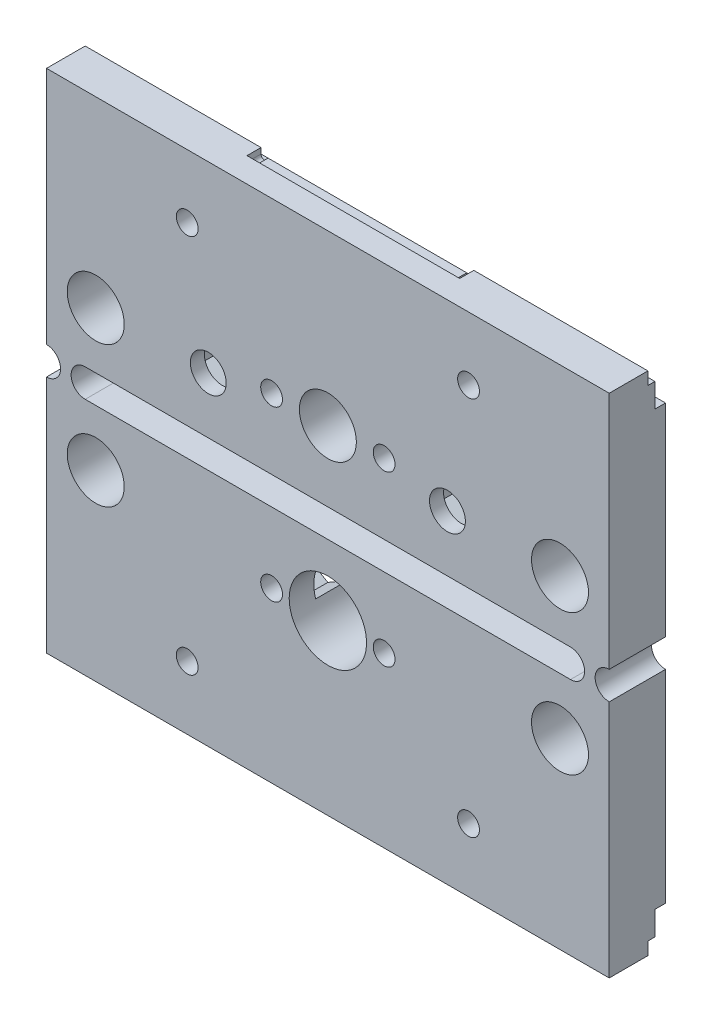
from build123d import *

# Parameters (mm, degrees)
SKETCH_2_W           = 80
SKETCH_2_H           = 34
SKETCH_2_R           = 4.05
EXTRUDE_1_DEPTH      = 8
SKETCH_3_R           = 2.55
CUT_EXTRUDE_1_DEPTH  = 88.292611371
CUT_EXTRUDE_2_DEPTH  = 88.292611371
SKETCH_5_R           = 1.55
CUT_EXTRUDE_3_DEPTH  = 88.292611371
CUT_EXTRUDE_4_DEPTH  = 6
CUT_EXTRUDE_5_DEPTH  = 4.5
SKETCH_25_R          = 1.55
CUT_EXTRUDE_13_DEPTH = 88.292611371
CUT_EXTRUDE_11_DEPTH = 2
EXTRUDE_2_DEPTH      = 8
SKETCH_26_R          = 5.5
CUT_EXTRUDE_14_DEPTH = 89.926936302


with BuildPart() as part:
    # 草图2 → 凸台-拉伸1 (new body)
    with BuildSketch(Plane.XY):
        with Locations((40, 17)):
            Rectangle(SKETCH_2_W, SKETCH_2_H)
        with Locations((7, 8)):
            Circle(SKETCH_2_R, mode=Mode.SUBTRACT)
        with Locations((40, 10)):
            Circle(SKETCH_2_R, mode=Mode.SUBTRACT)
        with Locations((73, 8)):
            Circle(SKETCH_2_R, mode=Mode.SUBTRACT)
    extrude_1 = extrude(amount=EXTRUDE_1_DEPTH)

    # 草图3 → 切除-拉伸1 (cut, through all)
    with BuildSketch(Plane.XY.offset(8)):
        with Locations((23, 8)):
            Circle(SKETCH_3_R)
        with Locations((57, 8)):
            Circle(SKETCH_3_R)
    extrude(amount=-CUT_EXTRUDE_1_DEPTH, mode=Mode.SUBTRACT)

    # 草图4 → 切除-拉伸2 (cut, through all)
    with BuildSketch(Plane(origin=(80, 0, 0), x_dir=(0, 0, -1), z_dir=(1, 0, 0))):
        Polygon((-1.5, 32.2), (-2.5, 32.2), (-2.5, 34), (0, 34), (0, 28.8), (-1.5, 28.8), align=None)
    cut_extrude_2 = extrude(amount=-CUT_EXTRUDE_2_DEPTH, mode=Mode.SUBTRACT)

    # 草图5 → 切除-拉伸3 (cut, through all)
    with BuildSketch(Plane.XY.offset(8)):
        with Locations((48, 10)):
            Circle(SKETCH_5_R)
        with Locations((32, 10)):
            Circle(SKETCH_5_R)
    cut_extrude_3 = extrude(amount=-CUT_EXTRUDE_3_DEPTH, mode=Mode.SUBTRACT)

    # 草图7 → 切除-拉伸4 (cut)
    with BuildSketch(Plane(origin=(0, 0, 0), x_dir=(-1, 0, 0), z_dir=(0, 0, -1))):
        Polygon((-52.9, 5.632863896), (-52.9, 10.367136104), (-57, 12.734272207), (-61.1, 10.367136104), (-61.1, 5.632863896), (-57, 3.265727793), align=None)
        Polygon((-27.1, 5.632863896), (-23, 3.265727793), (-18.9, 5.632863896), (-18.9, 10.367136104), (-23, 12.734272207), (-27.1, 10.367136104), align=None)
    extrude(amount=-CUT_EXTRUDE_4_DEPTH, mode=Mode.SUBTRACT)

    # 草图8 → 切除-拉伸5 (cut)
    with BuildSketch(Plane(origin=(0, 0, 0), x_dir=(-1, 0, 0), z_dir=(0, 0, -1))):
        Polygon((-48, 6.709103466), (-45.15, 8.354551733), (-45.15, 11.645448267), (-48, 13.290896534), (-50.85, 11.645448267), (-50.85, 8.354551733), align=None)
        Polygon((-32, 6.709103466), (-29.15, 8.354551733), (-29.15, 11.645448267), (-32, 13.290896534), (-34.85, 11.645448267), (-34.85, 8.354551733), align=None)
    cut_extrude_5 = extrude(amount=-CUT_EXTRUDE_5_DEPTH, mode=Mode.SUBTRACT)

    # 草图25 → 切除-拉伸13 (cut, through all)
    with BuildSketch(Plane(origin=(0, 0, 0), x_dir=(-1, 0, 0), z_dir=(0, 0, -1))):
        with Locations((-60, 25)):
            Circle(SKETCH_25_R)
        with Locations((-20, 25)):
            Circle(SKETCH_25_R)
    cut_extrude_13 = extrude(amount=-CUT_EXTRUDE_13_DEPTH, mode=Mode.SUBTRACT)

    # 草图19 → 切除-拉伸11 (cut)
    with BuildSketch(Plane(origin=(0, 0, 2.5), x_dir=(-1, 0, 0), z_dir=(0, 0, -1))):
        with BuildLine():
            Line((-25, 34), (-55.247938178, 34))
            Line((-55.247938178, 34), (-55.247938178, 33.2))
            ThreePointArc((-55.247938178, 33.2), (-54.747938178, 32.7), (-54.247938178, 33.2))
            Line((-54.247938178, 33.2), (-26, 33.2))
            ThreePointArc((-26, 33.2), (-25.5, 32.7), (-25, 33.2))
            Line((-25, 33.2), (-25, 34))
        make_face()
    cut_extrude_11 = extrude(amount=-CUT_EXTRUDE_11_DEPTH, mode=Mode.SUBTRACT)

    # 草图22 → 凸台-拉伸2 (add)
    with BuildSketch(Plane.XY.offset(8)):
        with BuildLine():
            Line((0, -4), (5.5, -4))
            ThreePointArc((5.5, -4), (3.5, -2), (5.5, 0))
            Line((5.5, 0), (0, 0))
            ThreePointArc((0, 0), (2, -2), (0, -4))
        make_face()
        with BuildLine():
            Line((80, 0), (74.5, 0))
            ThreePointArc((74.5, 0), (76.5, -2), (74.5, -4))
            Line((74.5, -4), (80, -4))
            ThreePointArc((80, -4), (78, -2), (80, 0))
        make_face()
    extrude(amount=-EXTRUDE_2_DEPTH)

    # 镜向2: 凸台-拉伸1, 切除-拉伸2, 切除-拉伸3, 切除-拉伸5, 切除-拉伸13, 切除-拉伸11 across plane
    add(extrude_1.mirror(Plane(origin=(0, -2, 0), x_dir=(0, 0, 1), z_dir=(0, -1, 0))))
    add(cut_extrude_2.mirror(Plane(origin=(0, -2, 0), x_dir=(0, 0, 1), z_dir=(0, -1, 0))), mode=Mode.SUBTRACT)
    add(cut_extrude_3.mirror(Plane(origin=(0, -2, 0), x_dir=(0, 0, 1), z_dir=(0, -1, 0))), mode=Mode.SUBTRACT)
    add(cut_extrude_5.mirror(Plane(origin=(0, -2, 0), x_dir=(0, 0, 1), z_dir=(0, -1, 0))), mode=Mode.SUBTRACT)
    add(cut_extrude_13.mirror(Plane(origin=(0, -2, 0), x_dir=(0, 0, 1), z_dir=(0, -1, 0))), mode=Mode.SUBTRACT)
    add(cut_extrude_11.mirror(Plane(origin=(0, -2, 0), x_dir=(0, 0, 1), z_dir=(0, -1, 0))), mode=Mode.SUBTRACT)

    # 草图26 → 切除-拉伸14 (cut, through all)
    with BuildSketch(Plane(origin=(0, 0, 0), x_dir=(-1, 0, 0), z_dir=(0, 0, -1))):
        with Locations((-40, -14)):
            Circle(SKETCH_26_R)
    extrude(amount=-CUT_EXTRUDE_14_DEPTH, mode=Mode.SUBTRACT)


solid = part.part
